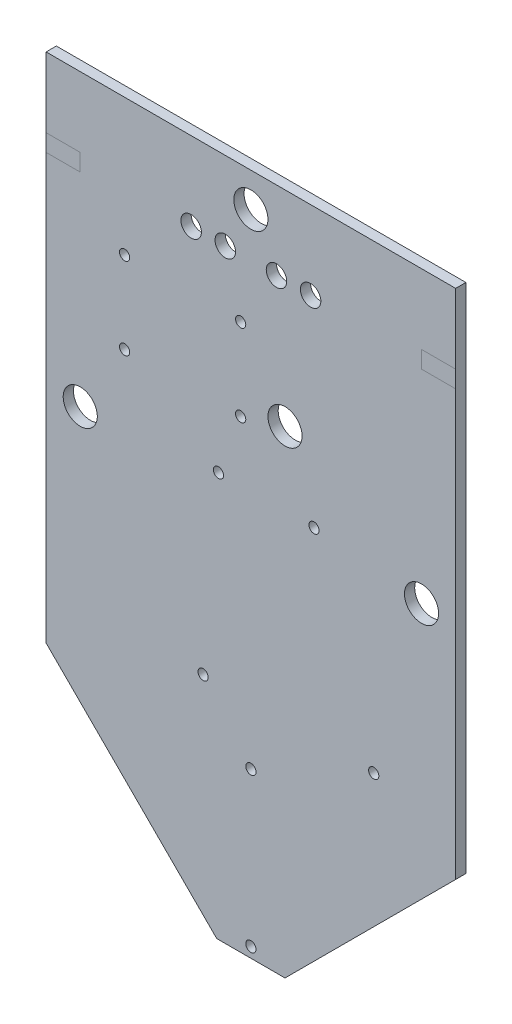
from build123d import *

# Parameters (mm, degrees)
EXTRUSION1_DEPTH        = 3
ESQUISSE2_R             = 1.5
ENL_V_MAT_EXTRU_1_DEPTH = 16
ESQUISSE3_R             = 5
ENL_V_MAT_EXTRU_2_DEPTH = 16
ESQUISSE4_R             = 5
ENL_V_MAT_EXTRU_3_DEPTH = 16
ESQUISSE5_R             = 1.5
ENL_V_MAT_EXTRU_4_DEPTH = 25.792218749
ESQUISSE8_R             = 3
ENL_V_MAT_EXTRU_5_DEPTH = 8
ESQUISSE9_R             = 1.5
ENL_V_MAT_EXTRU_6_DEPTH = 10
ESQUISSE11_W            = 10
ESQUISSE11_H            = 5
ENL_V_MAT_EXTRU_9_DEPTH = 0.0001


with BuildPart() as part:
    # Esquisse1 → Extrusion1 (new body)
    with BuildSketch(Plane.XY):
        Polygon((0, 0), (-120, 0), (-120, -150), (-70, -200), (-50, -200), (0, -150), align=None)
    extrude(amount=EXTRUSION1_DEPTH)

    # Esquisse2 → Enlèv. mat.-Extru.1 (cut)
    with BuildSketch(Plane.XY):
        with Locations(Location((-69.5, -81.5, 0), (0, 0, 180))):
            Circle(ESQUISSE2_R)
        with Locations(Location((-41.5, -81.5, 0), (0, 0, 180))):
            Circle(ESQUISSE2_R)
        with Locations(Location((-74, -135, 0), (0, 0, 180))):
            Circle(ESQUISSE2_R)
        with Locations(Location((-24, -135, 0), (0, 0, 180))):
            Circle(ESQUISSE2_R)
    extrude(amount=ENL_V_MAT_EXTRU_1_DEPTH, mode=Mode.SUBTRACT)

    # Esquisse3 → Enlèv. mat.-Extru.2 (cut)
    with BuildSketch(Plane(origin=(0, 0, 0), x_dir=(-1, 0, 0), z_dir=(0, 0, -1))):
        with Locations((50, -60)):
            Circle(ESQUISSE3_R)
    extrude(amount=-ENL_V_MAT_EXTRU_2_DEPTH, mode=Mode.SUBTRACT)

    # Esquisse4 → Enlèv. mat.-Extru.3 (cut)
    with BuildSketch(Plane(origin=(0, 0, 0), x_dir=(-1, 0, 0), z_dir=(0, 0, -1))):
        with Locations((60, -10)):
            Circle(ESQUISSE4_R)
        with Locations((10, -85)):
            Circle(ESQUISSE4_R)
        with Locations((110, -85)):
            Circle(ESQUISSE4_R)
    extrude(amount=-ENL_V_MAT_EXTRU_3_DEPTH, mode=Mode.SUBTRACT)

    # Esquisse5 → Enlèv. mat.-Extru.4 (cut)
    with BuildSketch(Plane.XY):
        with Locations(Location((-97, -40, 0), (0, 0, 180))):
            Circle(ESQUISSE5_R)
        with Locations(Location((-63, -40, 0), (0, 0, 180))):
            Circle(ESQUISSE5_R)
        with Locations(Location((-63, -64, 0), (0, 0, 180))):
            Circle(ESQUISSE5_R)
        with Locations(Location((-97, -64, 0), (0, 0, 180))):
            Circle(ESQUISSE5_R)
    extrude(amount=ENL_V_MAT_EXTRU_4_DEPTH, mode=Mode.SUBTRACT)

    # Esquisse8 → Enlèv. mat.-Extru.5 (cut)
    with BuildSketch(Plane(origin=(0, 0, 0), x_dir=(-1, 0, 0), z_dir=(0, 0, -1))):
        with Locations((52.5, -23)):
            Circle(ESQUISSE8_R)
        with Locations((42.5, -23)):
            Circle(ESQUISSE8_R)
        with Locations((67.5, -23)):
            Circle(ESQUISSE8_R)
        with Locations((77.5, -23)):
            Circle(ESQUISSE8_R)
    extrude(amount=-ENL_V_MAT_EXTRU_5_DEPTH, mode=Mode.SUBTRACT)

    # Esquisse9 → Enlèv. mat.-Extru.6 (cut)
    with BuildSketch(Plane(origin=(0, 0, 0), x_dir=(-1, 0, 0), z_dir=(0, 0, -1))):
        with Locations((60, -152)):
            Circle(ESQUISSE9_R)
        with Locations((60, -197)):
            Circle(ESQUISSE9_R)
    extrude(amount=-ENL_V_MAT_EXTRU_6_DEPTH, mode=Mode.SUBTRACT)

    # Esquisse11 → Enlèv. mat.-Extru.9 (cut)
    with BuildSketch(Plane.XY.offset(3)):
        with Locations((-115, -23)):
            Rectangle(ESQUISSE11_W, ESQUISSE11_H)
        with Locations((-5, -23)):
            Rectangle(ESQUISSE11_W, ESQUISSE11_H)
    extrude(amount=-ENL_V_MAT_EXTRU_9_DEPTH, mode=Mode.SUBTRACT)


solid = part.part
